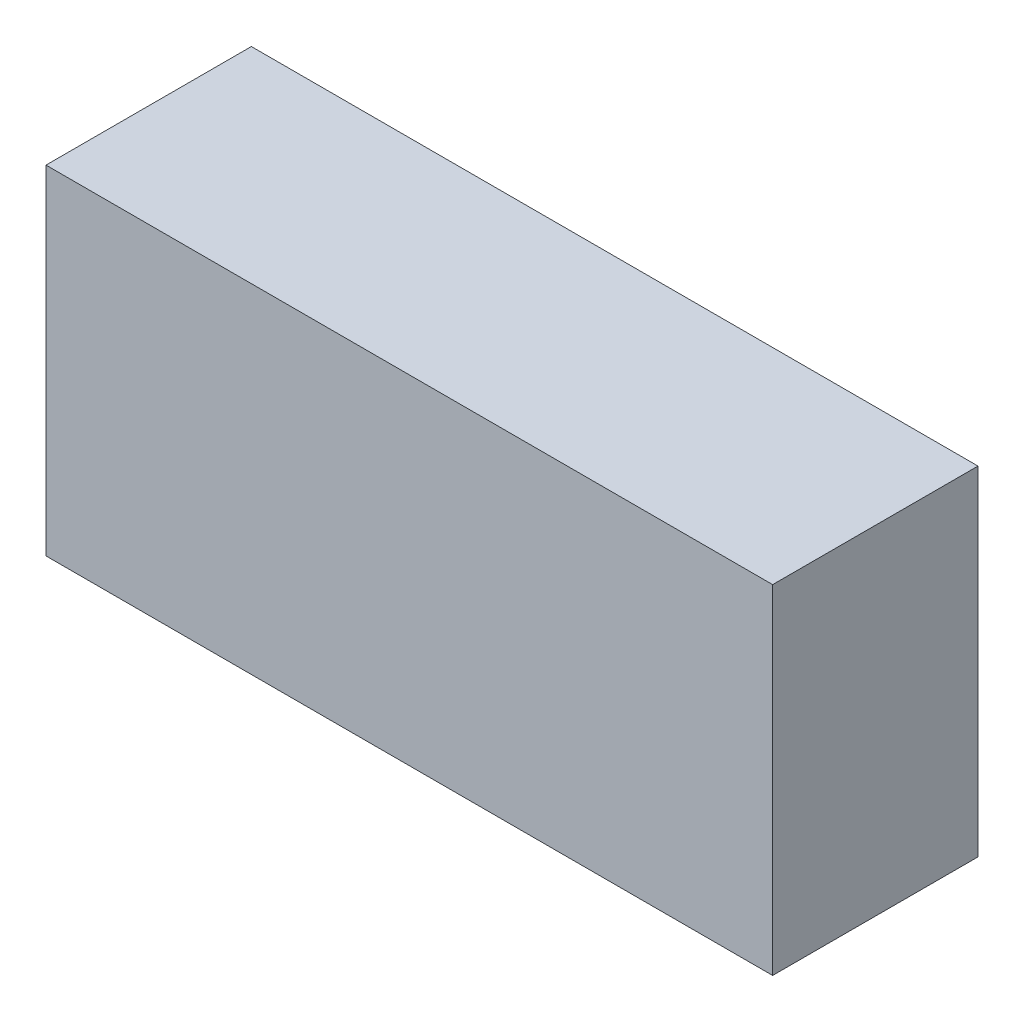
from build123d import *

# Parameters (mm, degrees)
SKETCH1_W           = 32.2
SKETCH1_H           = 9.1
BOSS_EXTRUDE1_DEPTH = 15


with BuildPart() as part:
    # Sketch1 → Boss-Extrude1 (new body)
    with BuildSketch(Plane(origin=(0, 0, 0), x_dir=(1, 0, 0), z_dir=(0, 1, 0))):
        Rectangle(SKETCH1_W, SKETCH1_H)
    extrude(amount=BOSS_EXTRUDE1_DEPTH)


solid = part.part
